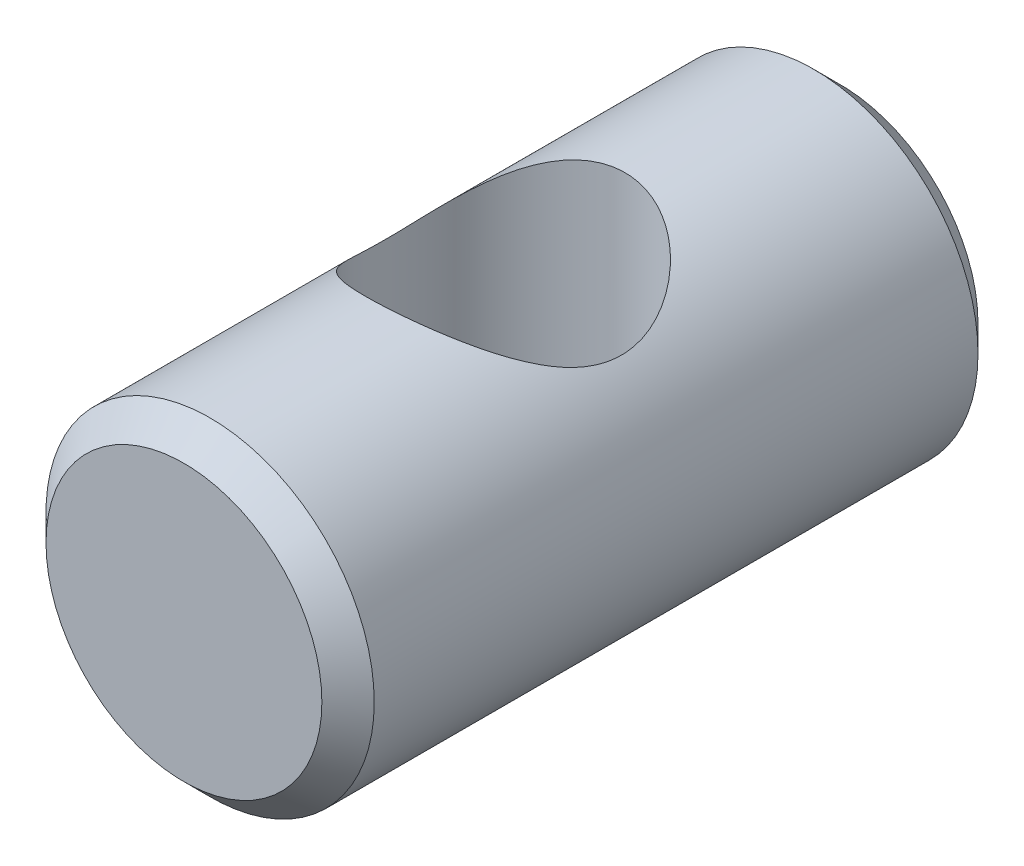
from build123d import *

# Parameters (mm, degrees)
SKETCH2_R               = 4.765
BOSS_EXTRUDE1_DEPTH     = 9.525
CUT_EXTRUDE1_DEPTH      = 12.667736499
CUT_EXTRUDE1_DEPTH_BACK = 12.667736499
SKETCH3_R               = 3.43
CHAMFER1_SIZE           = 0.76


with BuildPart() as part:
    # Sketch2 → Boss-Extrude1 (new, symmetric)
    with BuildSketch(Plane.XY):
        with Locations(Location((0, 0, 0), (0, 0, 180))):
            Circle(SKETCH2_R)
    extrude(amount=BOSS_EXTRUDE1_DEPTH, both=True)

    # Sketch3 → Cut-Extrude1 (cut, two sides: drawn at the far end of the back side and taken through both)
    with BuildSketch(Plane(origin=(0, 0, 0), x_dir=(1, 0, 0), z_dir=(0, 1, 0)).offset(-CUT_EXTRUDE1_DEPTH_BACK)):
        with Locations(Location((-0.25, 0, 0), (0, 0, 270))):
            Circle(SKETCH3_R)
    extrude(amount=CUT_EXTRUDE1_DEPTH + CUT_EXTRUDE1_DEPTH_BACK, mode=Mode.SUBTRACT)

    # Chamfer1
    chamfer1_edges = [part.edges().sort_by_distance(p)[0] for p in [
        (4.765, 0, -9.525),
        (4.765, 0, 9.525),
    ]]
    chamfer(chamfer1_edges, length=CHAMFER1_SIZE)


solid = part.part
